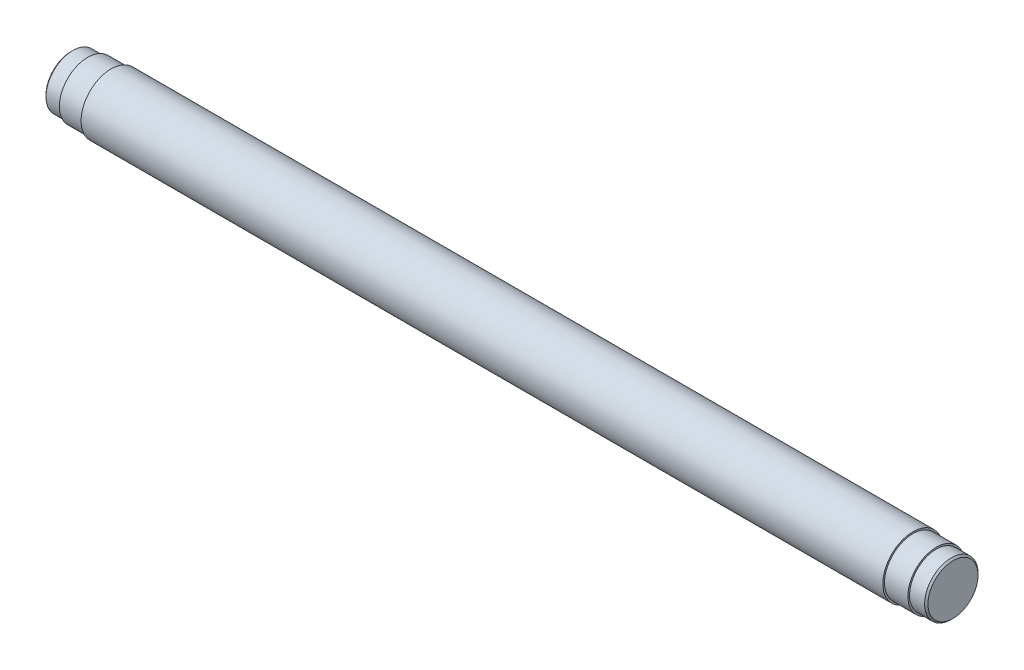
from build123d import *

# Parameters (mm, degrees)
CHAMFER_1_SIZE = 0.5
CHAMFER_2_SIZE = 0.5


with BuildPart() as part:
    # 草图1 → 旋转1 (revolve)
    with BuildSketch(Plane(origin=(0, 0, 0), x_dir=(1, 0, 0), z_dir=(0, 1, 0)), mode=Mode.PRIVATE) as revolve_1_sk:
        Polygon((0, 0), (0, 8), (5, 8), (5, 8.5), (12, 8.5), (12, 9), (252, 9), (252, 8.5), (259, 8.5), (259, 8), (264, 8), (264, 0), align=None)
    revolve(revolve_1_sk.sketch.rotate(Axis((-102.487167665, 0, 0), (1, 0, 0)), 180), axis=Axis((-102.487167665, 0, 0), (1, 0, 0)))

    # 倒角1
    chamfer_1_edges = [part.edges().sort_by_distance(p)[0] for p in [
        (264, 0, -8),
    ]]
    chamfer(chamfer_1_edges, length=CHAMFER_1_SIZE)

    # 倒角2
    chamfer_2_edges = [part.edges().sort_by_distance(p)[0] for p in [
        (0, 0, -8),
    ]]
    chamfer(chamfer_2_edges, length=CHAMFER_2_SIZE)


solid = part.part
